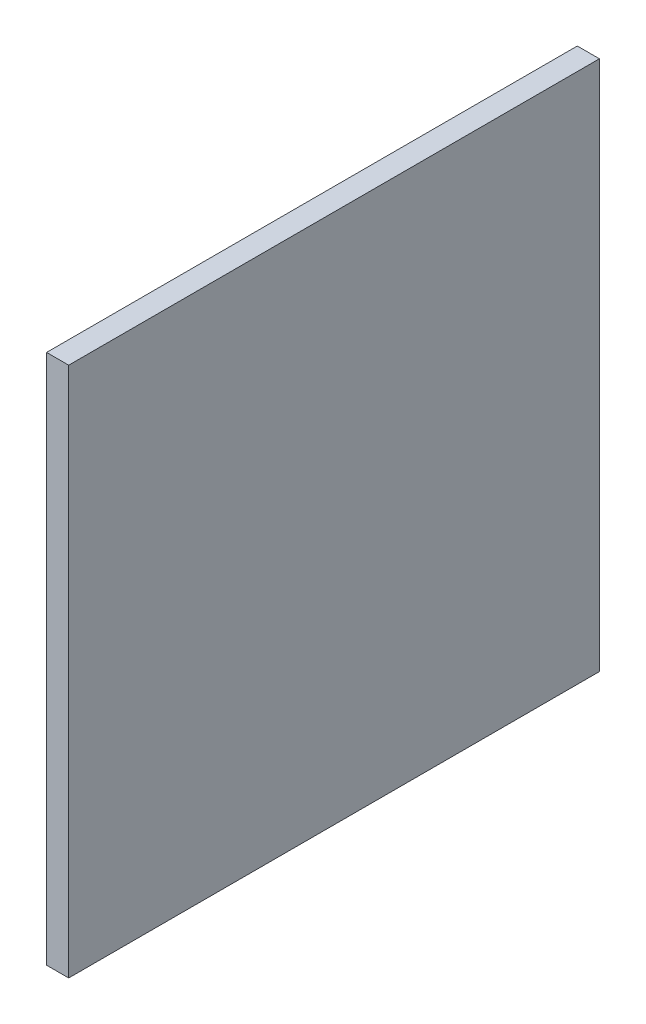
from build123d import *

# Parameters (mm, degrees)
SKETCH_8_W      = 2.5
SKETCH_8_H      = 60
EXTRUDE_4_DEPTH = 30


with BuildPart() as part:
    # 草图8 → 凸台-拉伸4 (new, symmetric)
    with BuildSketch(Plane.XY):
        Rectangle(SKETCH_8_W, SKETCH_8_H)
    extrude(amount=EXTRUDE_4_DEPTH, both=True)


solid = part.part
